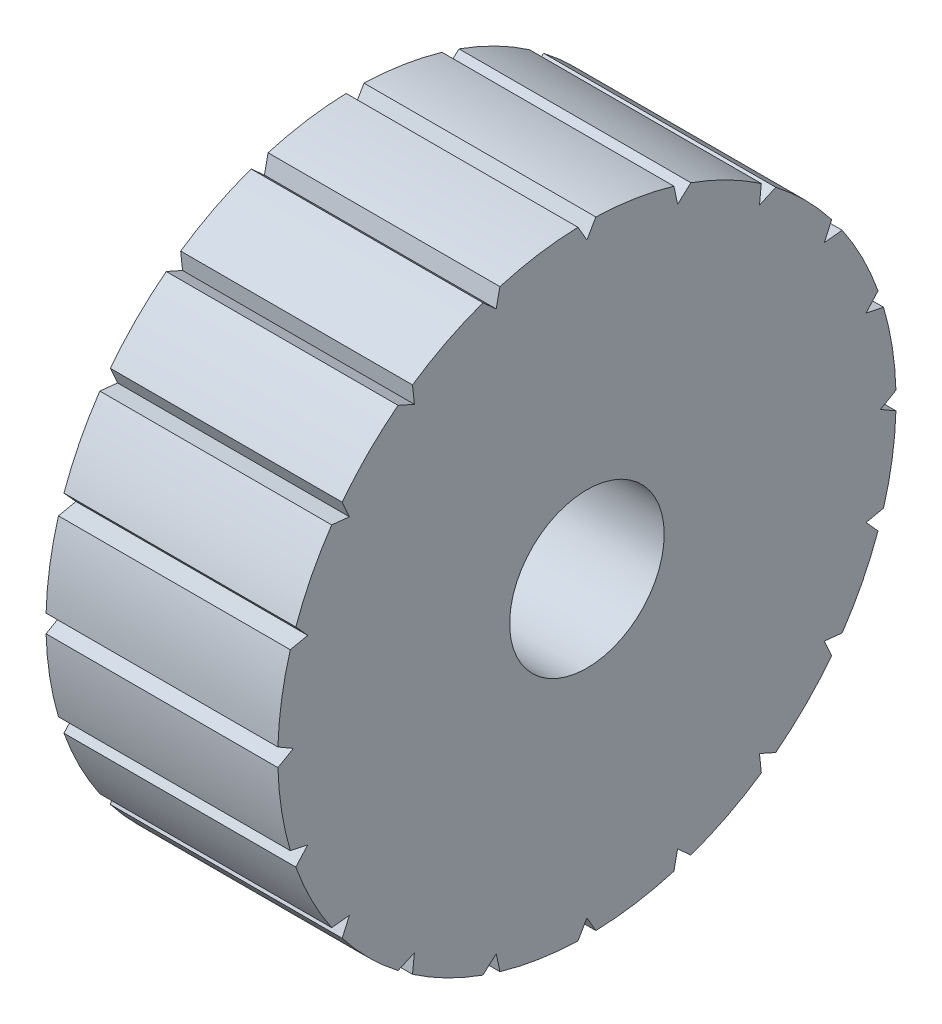
from build123d import *

# Parameters (mm, degrees)
SKETCH1_R           = 100
SKETCH1_R_2         = 25
BOSS_EXTRUDE1_DEPTH = 75
CUT_EXTRUDE1_DEPTH  = 161.078105936
CIRPATTERN1_COUNT   = 20


with BuildPart() as part:
    # Sketch1 → Boss-Extrude1 (new body)
    with BuildSketch(Plane(origin=(0, 0, 0), x_dir=(0, 0, -1), z_dir=(1, 0, 0))):
        Circle(SKETCH1_R)
        Circle(SKETCH1_R_2, mode=Mode.SUBTRACT)
    extrude(amount=BOSS_EXTRUDE1_DEPTH)

    # Sketch2 → Cut-Extrude1 (cut, through all)
    with BuildSketch(Plane(origin=(75, 0, 0), x_dir=(0, 0, -1), z_dir=(1, 0, 0))):
        with BuildLine():
            Line((2.886751346, 99.958324649), (0, 94.958324649))
            Line((0, 94.958324649), (-2.886751346, 99.958324649))
            ThreePointArc((-2.886751346, 99.958324649), (0, 100), (2.886751346, 99.958324649))
        make_face()
    cut_extrude1 = extrude(amount=-CUT_EXTRUDE1_DEPTH, mode=Mode.SUBTRACT)

    # CirPattern1: Cut-Extrude1 ×20 about axis
    cirpattern1_axis = Axis((0, 0, 0), (1, 0, 0))
    for i in range(1, CIRPATTERN1_COUNT):
        add(cut_extrude1.rotate(cirpattern1_axis, i * 360 / CIRPATTERN1_COUNT), mode=Mode.SUBTRACT)


solid = part.part
